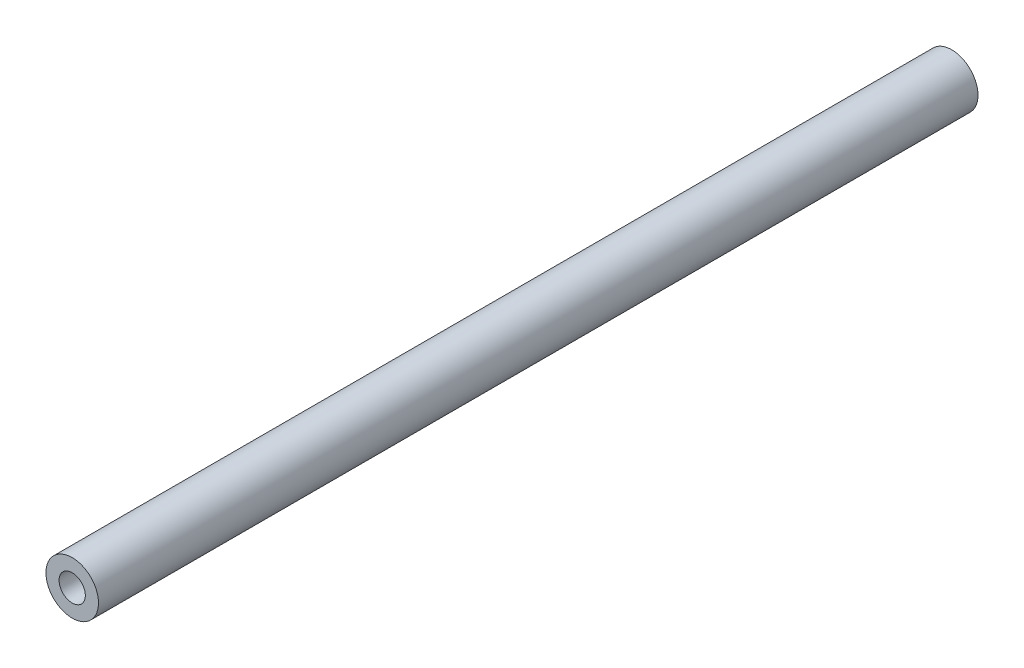
from build123d import *

# Parameters (mm, degrees)
SKETCH1_R      = 4
EXTRUDE1_DEPTH = 134
SKETCH2_R      = 2
EXTRUDE2_DEPTH = 10
EXTRUDE3_START = -10
SKETCH3_R      = 2
EXTRUDE3_DEPTH = 10


with BuildPart() as part:
    # Sketch1 → Extrude1 (new body)
    with BuildSketch(Plane.XY):
        Circle(SKETCH1_R)
    extrude(amount=EXTRUDE1_DEPTH)

    # Sketch2 → Extrude2 (cut)
    with BuildSketch(Plane.XY.offset(134)):
        Circle(SKETCH2_R)
    extrude(amount=-EXTRUDE2_DEPTH, mode=Mode.SUBTRACT)

    # Sketch3 → Extrude3 (cut)
    with BuildSketch(Plane(origin=(0, 0, 0), x_dir=(-1, 0, 0), z_dir=(0, 0, -1)).offset(EXTRUDE3_START)):
        with Locations(Location((0, 0, 0), (0, 0, 180))):
            Circle(SKETCH3_R)
    extrude(amount=EXTRUDE3_DEPTH, mode=Mode.SUBTRACT)


solid = part.part
